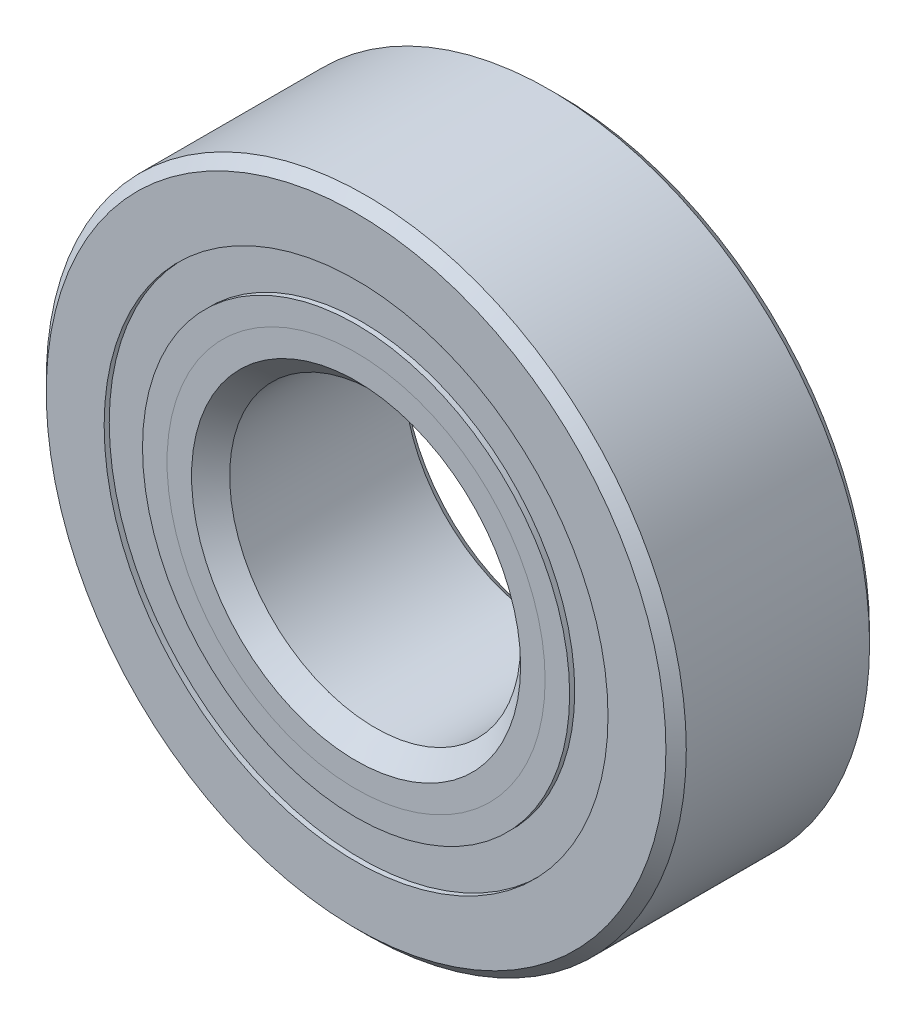
from build123d import *

# Parameters (mm, degrees)
CIRPATTERN1_COUNT = 12
SKETCH5_W         = 2.596321981
SKETCH5_H         = 2.093406594


with BuildPart() as part:
    # Sketch1 → Revolve1 (revolve)
    with BuildSketch(Plane(origin=(0, 0, 0), x_dir=(0, 0, -1), z_dir=(1, 0, 0))):
        with BuildLine():
            Line((5.000625, 17.4625), (-5.000625, 17.4625))
            Line((-5.000625, 17.4625), (-5.55625, 16.906875))
            Line((-5.55625, 16.906875), (-5.55625, 13.746703297))
            Line((-5.55625, 13.746703297), (-2.469444444, 13.746703297))
            ThreePointArc((-2.469444444, 13.746703297), (0, 15.382115519), (2.469444444, 13.746703297))
            Line((2.469444444, 13.746703297), (5.55625, 13.746703297))
            Line((5.55625, 13.746703297), (5.55625, 16.906875))
            Line((5.55625, 16.906875), (5.000625, 17.4625))
        make_face()
    revolve(axis=Axis((0, 0, 5.55625), (0, 0, -1)))


with BuildPart() as body_2:
    # Sketch2 → Revolve2 (revolve)
    with BuildSketch(Plane(origin=(0, 0, 0), x_dir=(0, 0, -1), z_dir=(1, 0, 0))):
        with BuildLine():
            Line((-5.55625, 11.653296703), (-2.469444444, 11.653296703))
            ThreePointArc((-2.469444444, 11.653296703), (-1.480939651, 10.463806492), (0, 10.017884481))
            Line((0, 10.017884481), (0, 8.977692241))
            Line((0, 8.977692241), (-4.218447769, 8.977692241))
            Line((-4.218447769, 8.977692241), (-5.55625, 10.315494472))
            Line((-5.55625, 10.315494472), (-5.55625, 11.653296703))
        make_face()
    revolve(axis=Axis((0, 0, 5.55625), (0, 0, -1)))


with BuildPart() as body_3:
    # Sketch3 → Revolve3 (revolve)
    with BuildSketch(Plane(origin=(0, 0, 0), x_dir=(0, 0, -1), z_dir=(1, 0, 0))):
        with BuildLine():
            Line((-5.55625, 10.315494472), (-4.218447769, 8.977692241))
            Line((-4.218447769, 8.977692241), (0, 8.977692241))
            Line((0, 8.977692241), (0, 10.017884481))
            ThreePointArc((0, 10.017884481), (1.480939651, 10.463806492), (2.469444444, 11.653296703))
            Line((2.469444444, 11.653296703), (5.55625, 11.653296703))
            Line((5.55625, 11.653296703), (5.55625, 8.493125))
            Line((5.55625, 8.493125), (5.000625, 7.9375))
            Line((5.000625, 7.9375), (-4.516057759, 7.9375))
            Line((-4.516057759, 7.9375), (-5.55625, 8.977692241))
            Line((-5.55625, 8.977692241), (-5.55625, 10.315494472))
        make_face()
    revolve(axis=Axis((0, 0, 5.55625), (0, 0, -1)))


with BuildPart() as body_4:
    # Sketch4 → Revolve4 (revolve)
    with BuildSketch(Plane(origin=(0, 0, 0), x_dir=(0, 0, -1), z_dir=(1, 0, 0))):
        with BuildLine():
            Line((-2.682115519, 12.7), (2.682115519, 12.7))
            ThreePointArc((2.682115519, 12.7), (0, 15.382115519), (-2.682115519, 12.7))
        make_face()
    revolve(axis=Axis((0, 12.7, 2.682115519), (0, 0, -1)))


with BuildPart() as cirpattern1_1:
    # CirPattern1: pattern copy
    add(body_4.part.rotate(Axis((0, 0, -5.55625), (0, 0, 1)), 1 * 360 / CIRPATTERN1_COUNT))


with BuildPart() as cirpattern1_2:
    # CirPattern1: pattern copy
    add(body_4.part.rotate(Axis((0, 0, -5.55625), (0, 0, 1)), 2 * 360 / CIRPATTERN1_COUNT))


with BuildPart() as cirpattern1_3:
    # CirPattern1: pattern copy
    add(body_4.part.rotate(Axis((0, 0, -5.55625), (0, 0, 1)), 3 * 360 / CIRPATTERN1_COUNT))


with BuildPart() as cirpattern1_4:
    # CirPattern1: pattern copy
    add(body_4.part.rotate(Axis((0, 0, -5.55625), (0, 0, 1)), 4 * 360 / CIRPATTERN1_COUNT))


with BuildPart() as cirpattern1_5:
    # CirPattern1: pattern copy
    add(body_4.part.rotate(Axis((0, 0, -5.55625), (0, 0, 1)), 5 * 360 / CIRPATTERN1_COUNT))


with BuildPart() as cirpattern1_6:
    # CirPattern1: pattern copy
    add(body_4.part.rotate(Axis((0, 0, -5.55625), (0, 0, 1)), 6 * 360 / CIRPATTERN1_COUNT))


with BuildPart() as cirpattern1_7:
    # CirPattern1: pattern copy
    add(body_4.part.rotate(Axis((0, 0, -5.55625), (0, 0, 1)), 7 * 360 / CIRPATTERN1_COUNT))


with BuildPart() as cirpattern1_8:
    # CirPattern1: pattern copy
    add(body_4.part.rotate(Axis((0, 0, -5.55625), (0, 0, 1)), 8 * 360 / CIRPATTERN1_COUNT))


with BuildPart() as cirpattern1_9:
    # CirPattern1: pattern copy
    add(body_4.part.rotate(Axis((0, 0, -5.55625), (0, 0, 1)), 9 * 360 / CIRPATTERN1_COUNT))


with BuildPart() as cirpattern1_10:
    # CirPattern1: pattern copy
    add(body_4.part.rotate(Axis((0, 0, -5.55625), (0, 0, 1)), 10 * 360 / CIRPATTERN1_COUNT))


with BuildPart() as cirpattern1_11:
    # CirPattern1: pattern copy
    add(body_4.part.rotate(Axis((0, 0, -5.55625), (0, 0, 1)), 11 * 360 / CIRPATTERN1_COUNT))


with BuildPart() as body_16:
    # Sketch5 → Revolve5 (revolve)
    with BuildSketch(Plane(origin=(0, 0, 0), x_dir=(0, 0, -1), z_dir=(1, 0, 0))):
        with Locations((-3.98027651, 12.7)):
            Rectangle(SKETCH5_W, SKETCH5_H)
        with Locations((3.98027651, 12.7)):
            Rectangle(SKETCH5_W, SKETCH5_H)
    revolve(axis=Axis((0, 0, 5.55625), (0, 0, -1)))


solid = Compound([part.part, body_2.part, body_3.part, body_4.part, cirpattern1_1.part, cirpattern1_2.part, cirpattern1_3.part, cirpattern1_4.part, cirpattern1_5.part, cirpattern1_6.part, cirpattern1_7.part, cirpattern1_8.part, cirpattern1_9.part, cirpattern1_10.part, cirpattern1_11.part, body_16.part])
